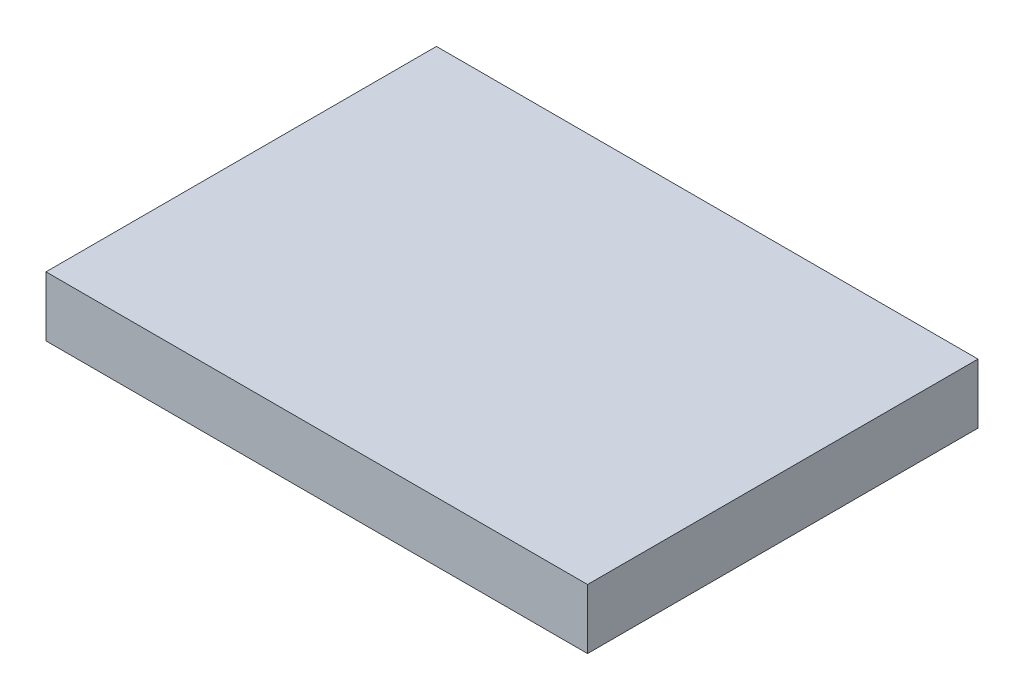
from build123d import *

# Parameters (mm, degrees)
ESBO_O2_W                = 360
ESBO_O2_H                = 260
RESSALTO_EXTRUS_O1_DEPTH = 1
ESBO_O3_W                = 260
ESBO_O3_H                = 40
RESSALTO_EXTRUS_O2_DEPTH = 1
ESBO_O5_W                = 361
ESBO_O5_H                = 40
RESSALTO_EXTRUS_O3_DEPTH = 1
ESBO_O6_W                = 261
ESBO_O6_H                = 40
RESSALTO_EXTRUS_O4_DEPTH = 1


with BuildPart() as part:
    # Esboço2 → Ressalto-extrusão1 (new body)
    with BuildSketch(Plane(origin=(0, 0, 0), x_dir=(1, 0, 0), z_dir=(0, 1, 0))):
        Rectangle(ESBO_O2_W, ESBO_O2_H)
    extrude(amount=RESSALTO_EXTRUS_O1_DEPTH)

    # Esboço3 → Ressalto-extrusão2 (add)
    with BuildSketch(Plane.ZY.offset(180)):
        with Locations((0, -19)):
            Rectangle(ESBO_O3_W, ESBO_O3_H)
    extrude(amount=RESSALTO_EXTRUS_O2_DEPTH)

    # Esboço5 → Ressalto-extrusão3 (add)
    with BuildSketch(Plane.XY.offset(130)):
        with Locations((-0.5, -19)):
            Rectangle(ESBO_O5_W, ESBO_O5_H)
    extrude(amount=RESSALTO_EXTRUS_O3_DEPTH)

    # Esboço6 → Ressalto-extrusão4 (add)
    with BuildSketch(Plane(origin=(180, 0, 0), x_dir=(0, 0, -1), z_dir=(1, 0, 0))):
        with Locations((-0.5, -19)):
            Rectangle(ESBO_O6_W, ESBO_O6_H)
    extrude(amount=RESSALTO_EXTRUS_O4_DEPTH)


solid = part.part
